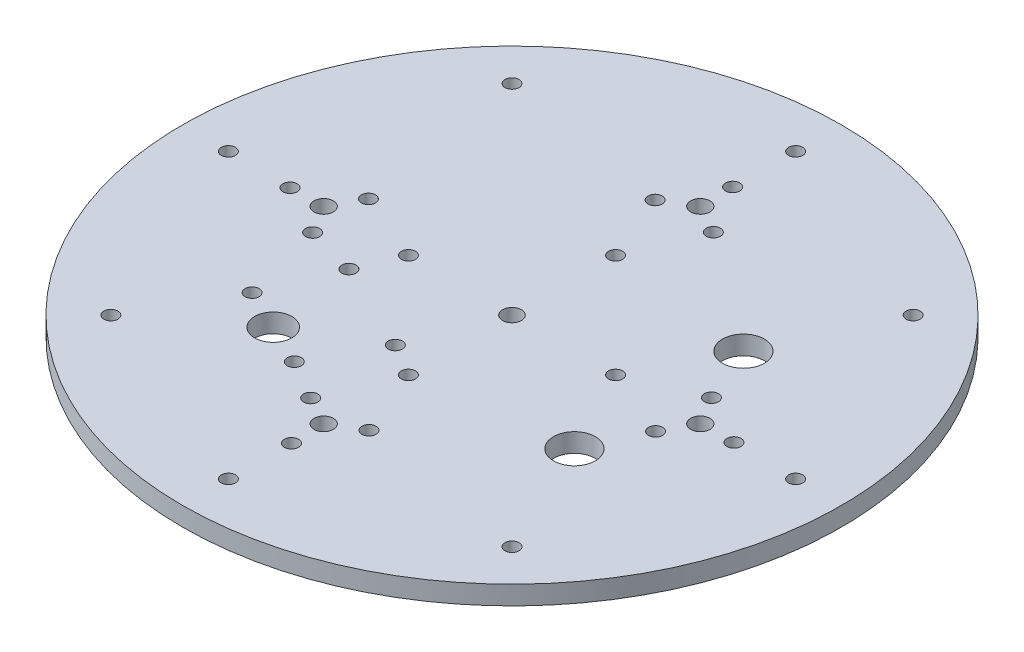
from build123d import *

# Parameters (mm, degrees)
SKETCH2_R           = 70
BOSS_EXTRUDE1_DEPTH = 4
SKETCH8_R           = 2
CUT_EXTRUDE1_DEPTH  = 100.075728612
SKETCH34_R          = 1.5
CUT_EXTRUDE8_DEPTH  = 100.075728612
CIRPATTERN7_COUNT   = 8
SKETCH56_R          = 2.05
CUT_EXTRUDE19_DEPTH = 100.075728612
SKETCH57_R          = 1.5
CUT_EXTRUDE20_DEPTH = 100.075728612
CIRPATTERN13_COUNT  = 4
SKETCH60_R          = 1.5
CUT_EXTRUDE21_DEPTH = 100.075728612
CIRPATTERN14_COUNT  = 4
SKETCH49_R          = 4.45
SKETCH49_R_2        = 3.95
CUT_EXTRUDE14_DEPTH = 100.075728612
SKETCH63_R          = 1.5
CUT_EXTRUDE24_DEPTH = 100.075728612


with BuildPart() as part:
    # Sketch2 → Boss-Extrude1 (new body)
    with BuildSketch(Plane(origin=(0, 0, 0), x_dir=(1, 0, 0), z_dir=(0, 1, 0))):
        Circle(SKETCH2_R)
    extrude(amount=BOSS_EXTRUDE1_DEPTH)

    # Sketch8 → Cut-Extrude1 (cut, through all)
    with BuildSketch(Plane(origin=(0, 4, 0), x_dir=(1, 0, 0), z_dir=(0, 1, 0))):
        Circle(SKETCH8_R)
    extrude(amount=-CUT_EXTRUDE1_DEPTH, mode=Mode.SUBTRACT)

    # Sketch34 → Cut-Extrude8 (cut, through all)
    with BuildSketch(Plane(origin=(0, 4, 0), x_dir=(1, 0, 0), z_dir=(0, 1, 0))):
        with Locations((-60.25, 0)):
            Circle(SKETCH34_R)
    cut_extrude8 = extrude(amount=-CUT_EXTRUDE8_DEPTH, mode=Mode.SUBTRACT)

    # CirPattern7: Cut-Extrude8 ×8 about axis
    cirpattern7_axis = Axis((0, 4, 0), (0, -1, 0))
    for i in range(1, CIRPATTERN7_COUNT):
        add(cut_extrude8.rotate(cirpattern7_axis, i * 360 / CIRPATTERN7_COUNT), mode=Mode.SUBTRACT)

    # Sketch56 → Cut-Extrude19 (cut, through all)
    with BuildSketch(Plane(origin=(0, 4, 0), x_dir=(1, 0, 0), z_dir=(0, 1, 0))):
        with Locations((0, 40)):
            Circle(SKETCH56_R)
        with Locations((-40, 0)):
            Circle(SKETCH56_R)
        with Locations((40, 0)):
            Circle(SKETCH56_R)
        with Locations((0, -40)):
            Circle(SKETCH56_R)
    extrude(amount=-CUT_EXTRUDE19_DEPTH, mode=Mode.SUBTRACT)

    # Sketch57 → Cut-Extrude20 (cut, through all)
    with BuildSketch(Plane(origin=(0, 4, 0), x_dir=(1, 0, 0), z_dir=(0, 1, 0))):
        with Locations((-36.371259829, -5.986004074)):
            Circle(SKETCH57_R)
        with Locations((-46.998401681, -0.149579135)):
            Circle(SKETCH57_R)
        with Locations((-36.63033849, 6.135583209)):
            Circle(SKETCH57_R)
    cut_extrude20 = extrude(amount=-CUT_EXTRUDE20_DEPTH, mode=Mode.SUBTRACT)

    # CirPattern13: Cut-Extrude20 ×4 about axis
    cirpattern13_axis = Axis((0, 4, 0), (0, 1, 0))
    for i in range(1, CIRPATTERN13_COUNT):
        add(cut_extrude20.rotate(cirpattern13_axis, i * 360 / CIRPATTERN13_COUNT), mode=Mode.SUBTRACT)

    # Sketch60 → Cut-Extrude21 (cut, through all)
    with BuildSketch(Plane(origin=(0, 4, 0), x_dir=(1, 0, 0), z_dir=(0, 1, 0))):
        with Locations((22, 0)):
            Circle(SKETCH60_R)
    cut_extrude21 = extrude(amount=-CUT_EXTRUDE21_DEPTH, mode=Mode.SUBTRACT)

    # CirPattern14: Cut-Extrude21 ×4 about axis
    cirpattern14_axis = Axis((0, 4, 0), (0, -1, 0))
    for i in range(1, CIRPATTERN14_COUNT):
        add(cut_extrude21.rotate(cirpattern14_axis, i * 360 / CIRPATTERN14_COUNT), mode=Mode.SUBTRACT)

    # Sketch49 → Cut-Extrude14 (cut, through all)
    with BuildSketch(Plane.XZ):
        with Locations((31.205728641, 17.95)):
            Circle(SKETCH49_R)
        with Locations((31.205728641, -17.95)):
            Circle(SKETCH49_R)
        with Locations((-23.140353949, 27.577599952)):
            Circle(SKETCH49_R_2)
    extrude(amount=-CUT_EXTRUDE14_DEPTH, mode=Mode.SUBTRACT)

    # Sketch63 → Cut-Extrude24 (cut, through all)
    with BuildSketch(Plane(origin=(0, 4, 0), x_dir=(1, 0, 0), z_dir=(0, 1, 0))):
        with Locations((-25.789614102, -8.849040721)):
            Circle(SKETCH63_R)
        with Locations((-6.889395427, -17.89855778)):
            Circle(SKETCH63_R)
        with Locations((-31.731362438, -23.464183107)):
            Circle(SKETCH63_R)
        with Locations((-14.54934546, -31.691016798)):
            Circle(SKETCH63_R)
    extrude(amount=-CUT_EXTRUDE24_DEPTH, mode=Mode.SUBTRACT)


solid = part.part
